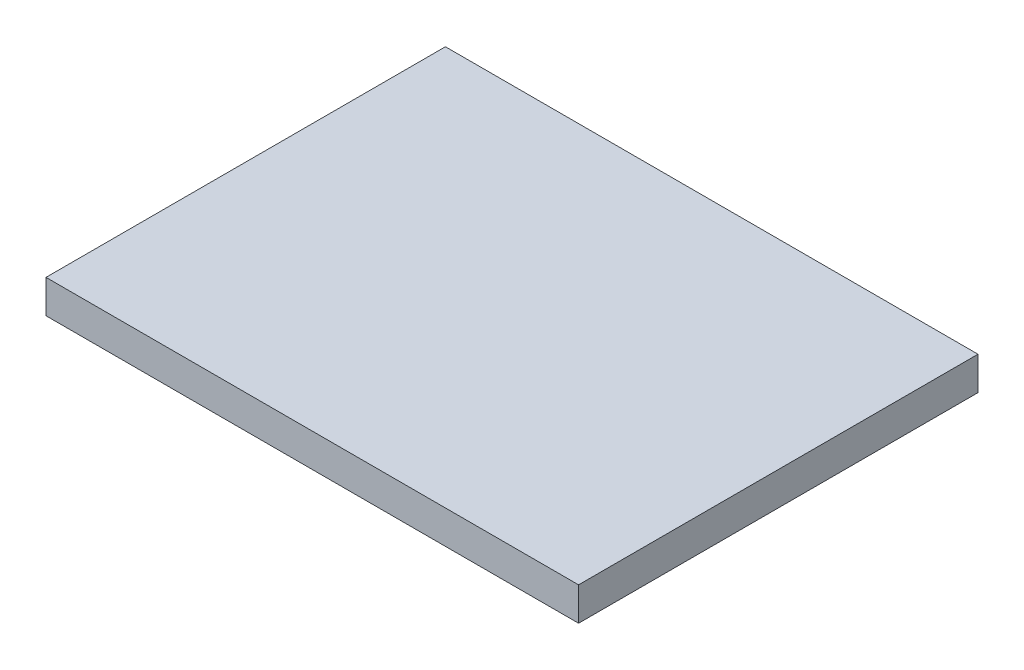
from build123d import *

# Parameters (mm, degrees)
SKETCH1_W           = 50.8
SKETCH1_H           = 38.1
BOSS_EXTRUDE1_DEPTH = 3.175


with BuildPart() as part:
    # Sketch1 → Boss-Extrude1 (new body)
    with BuildSketch(Plane(origin=(0, 0, 0), x_dir=(1, 0, 0), z_dir=(0, 1, 0))):
        with Locations((25.4, 19.05)):
            Rectangle(SKETCH1_W, SKETCH1_H)
    extrude(amount=BOSS_EXTRUDE1_DEPTH)


solid = part.part
